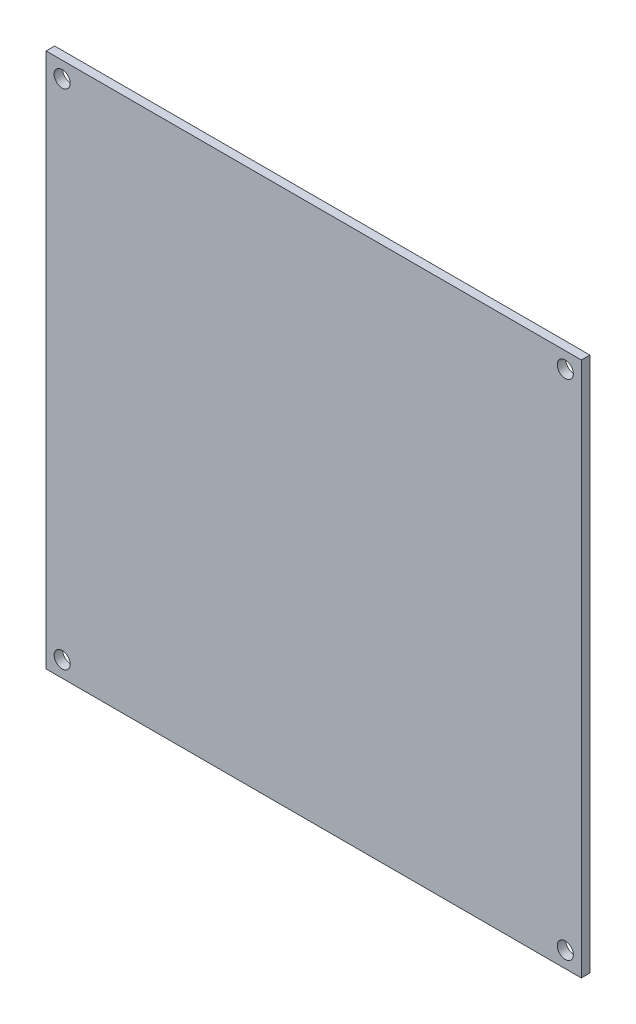
from build123d import *

# Parameters (mm, degrees)
SKETCH_1_W      = 100
SKETCH_1_H      = 100
SKETCH_1_R      = 1.5
EXTRUDE_1_DEPTH = 1.6


with BuildPart() as part:
    # 草图1 → 凸台-拉伸1 (new body)
    with BuildSketch(Plane.XY):
        with Locations((50, 50)):
            Rectangle(SKETCH_1_W, SKETCH_1_H)
        with Locations((3, 3)):
            Circle(SKETCH_1_R, mode=Mode.SUBTRACT)
        with Locations((97, 3)):
            Circle(SKETCH_1_R, mode=Mode.SUBTRACT)
        with Locations((97, 97)):
            Circle(SKETCH_1_R, mode=Mode.SUBTRACT)
        with Locations((3, 97)):
            Circle(SKETCH_1_R, mode=Mode.SUBTRACT)
    extrude(amount=EXTRUDE_1_DEPTH)


solid = part.part
